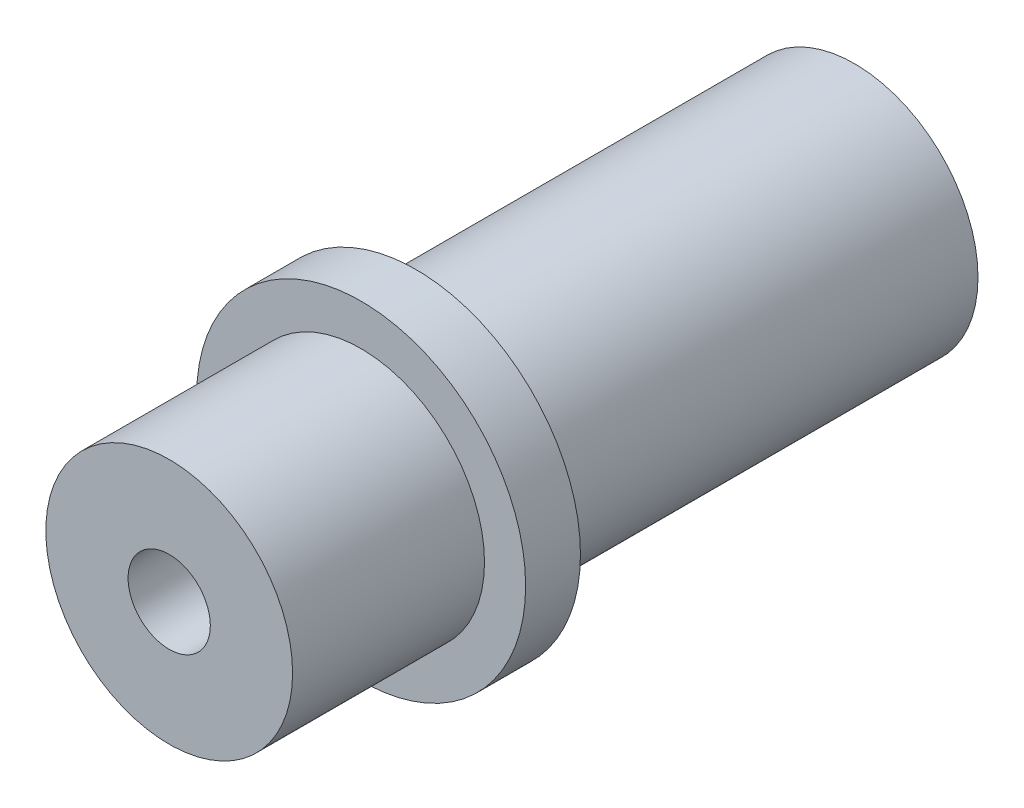
from build123d import *


with BuildPart() as part:
    # Çizim1 → Döndür1 (revolve)
    with BuildSketch(Plane(origin=(0, 0, 0), x_dir=(0, 0, -1), z_dir=(1, 0, 0)), mode=Mode.PRIVATE) as d_nd_r1_sk:
        Polygon((7.365702479, 5.625), (27.365702479, 5.625), (27.365702479, 1.875), (-3.884297521, 1.875), (-3.884297521, 5.625), (4.865702479, 5.625), (4.865702479, 7.5), (7.365702479, 7.5), align=None)
    revolve(d_nd_r1_sk.sketch.rotate(Axis((0, 0, 4.380165289), (0, 0, -1)), 90), axis=Axis((0, 0, 4.380165289), (0, 0, -1)))


solid = part.part
